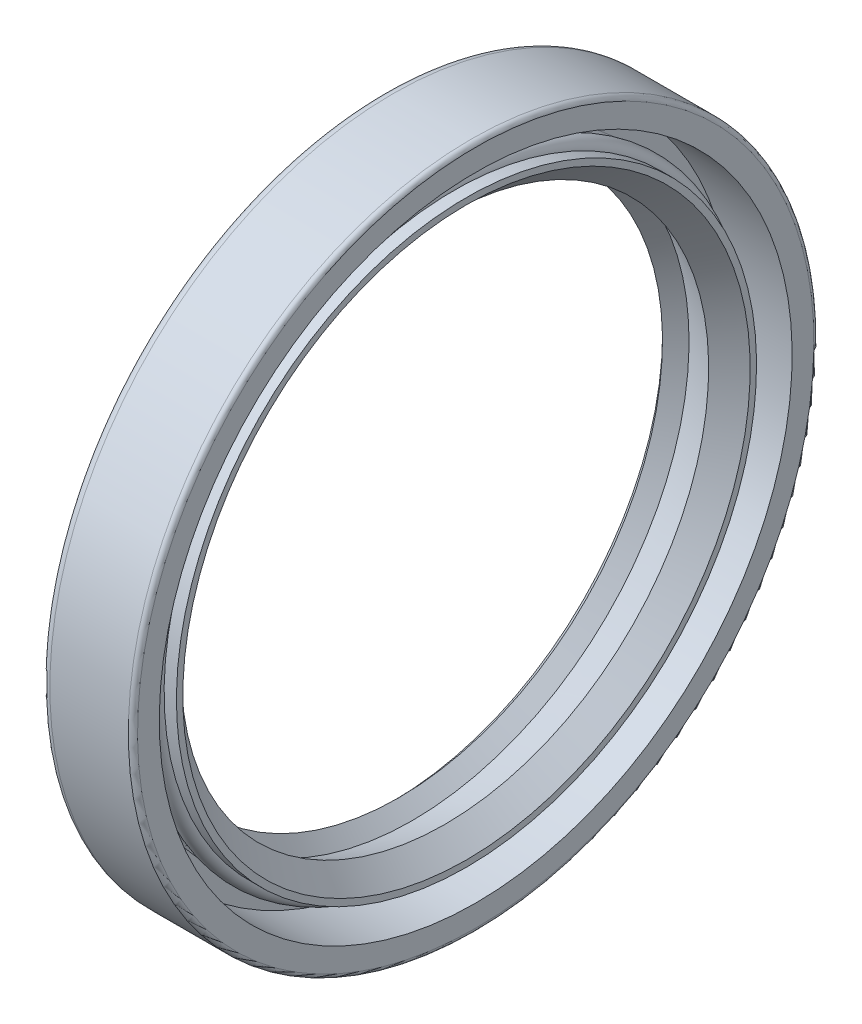
from build123d import *

# Parameters (mm, degrees)
SKETCH2_R = 0.7


with BuildPart() as part:
    # Sketch1 → Revolve1 (revolve)
    with BuildSketch(Plane.XY, mode=Mode.PRIVATE) as revolve1_sk:
        with BuildLine():
            Line((0, 24), (0.21875, 24))
            Line((0.21875, 24), (0.21875, 22))
            Line((0.21875, 22), (0, 22))
            Line((0, 22), (0, 21.5))
            Line((0, 21.5), (1.166666667, 21))
            Line((1.166666667, 21), (0.666719108, 20.507241434))
            Line((0.666719108, 20.507241434), (1.166666667, 20))
            Line((1.166666667, 20), (2.181255947, 21))
            Line((2.181255947, 21), (4.666666667, 20))
            Line((4.666666667, 20), (6.3, 21.516666667))
            Line((6.3, 21.516666667), (6.3, 22))
            Line((6.3, 22), (5.366666667, 22))
            ThreePointArc((5.366666667, 22), (4.666666667, 21.3), (3.966666667, 22))
            Line((3.966666667, 22), (2.683333333, 22))
            ThreePointArc((2.683333333, 22), (2.43584596, 22.102512627), (2.333333333, 22.35))
            Line((2.333333333, 22.35), (2.333333333, 24))
            Line((2.333333333, 24), (7, 24))
            Line((7, 24), (7, 25.65))
            ThreePointArc((7, 25.65), (6.897487373, 25.897487373), (6.65, 26))
            Line((6.65, 26), (0.7, 26))
            ThreePointArc((0.7, 26), (0.205025253, 25.794974747), (0, 25.3))
            Line((0, 25.3), (0, 24))
        make_face()
    revolve(revolve1_sk.sketch.rotate(Axis((7, 0, 0), (-1, 0, 0)), 180), axis=Axis((7, 0, 0), (-1, 0, 0)))


with BuildPart() as body_2:
    # Sketch2 → Revolve2 (revolve)
    with BuildSketch(Plane.XY, mode=Mode.PRIVATE) as revolve2_sk:
        with Locations((4.666666667, 22)):
            Circle(SKETCH2_R)
    revolve(revolve2_sk.sketch.rotate(Axis((0, 0, 0), (1, 0, 0)), 90), axis=Axis((0, 0, 0), (1, 0, 0)))


solid = Compound([part.part, body_2.part])
